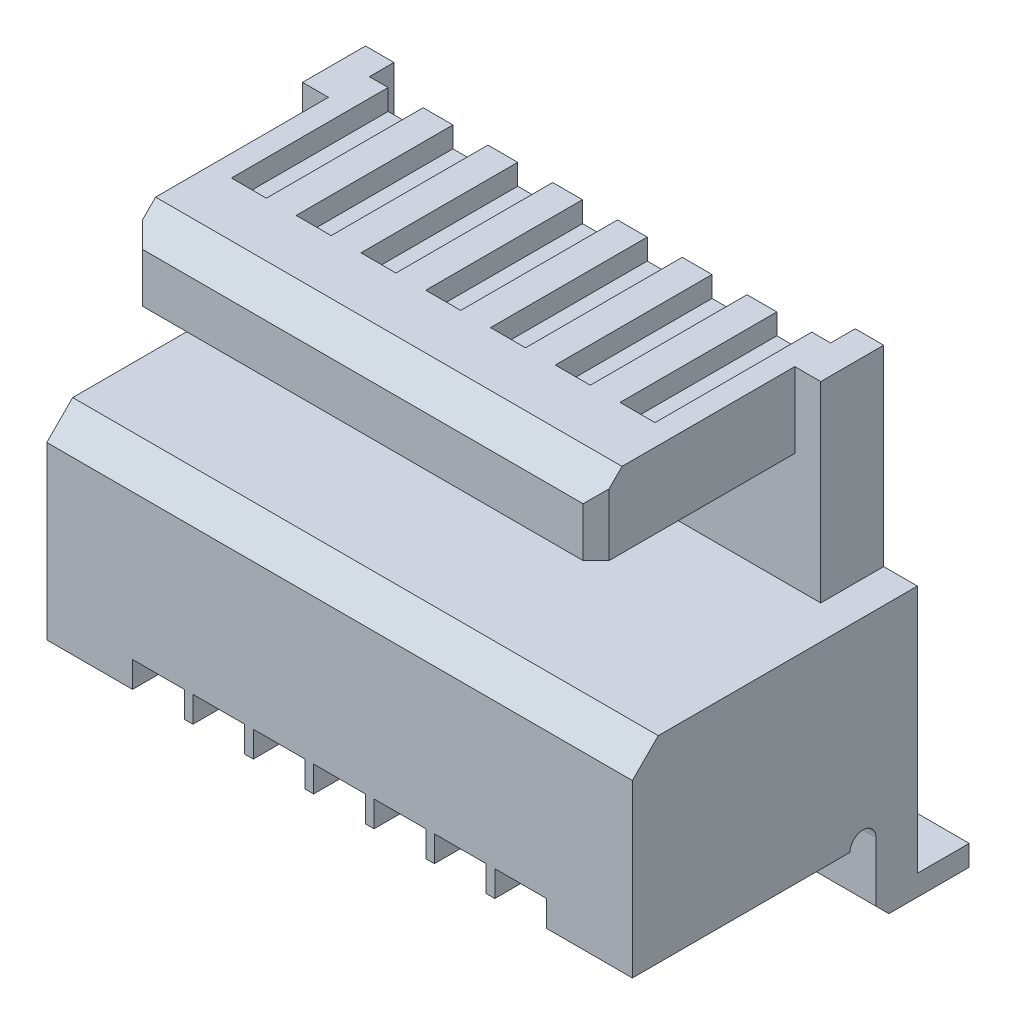
from build123d import *

# Parameters (mm, degrees)
BOSS_EXTRUDE1_DEPTH = 7.6
SKETCH2_W           = 17
SKETCH2_H           = 8.9
BOSS_EXTRUDE2_DEPTH = 2
SKETCH3_W           = 20
SKETCH3_H           = 2.43
BOSS_EXTRUDE3_DEPTH = 7.4
SKETCH4_W           = 18
SKETCH4_H           = 2.9
BOSS_EXTRUDE4_DEPTH = 7.67
CUT_EXTRUDE1_DEPTH  = 0.95
SKETCH6_W           = 1.35
SKETCH6_H           = 6.05
CUT_EXTRUDE2_DEPTH  = 0.8
CHAMFER1_SIZE       = 0.5
CHAMFER2_SIZE       = 1
CHAMFER3_SIZE       = 1
SKETCH7_W           = 2.8
SKETCH7_H           = 1.6
BOSS_EXTRUDE5_DEPTH = 2.8
SKETCH8_W           = 2.8
SKETCH8_H           = 0.8
BOSS_EXTRUDE6_DEPTH = 2
CUT_EXTRUDE3_DEPTH  = 30.270462928
CHAMFER4_SIZE       = 0.5
SKETCH10_W          = 2
SKETCH10_H          = 7.95
SKETCH10_W_2        = 1
CUT_EXTRUDE4_DEPTH  = 1
CUT_EXTRUDE5_DEPTH  = 1
SKETCH12_W          = 2
SKETCH12_H          = 1.1
CUT_EXTRUDE6_DEPTH  = 1


with BuildPart() as part:
    # Sketch1 → Boss-Extrude1 (new body)
    with BuildSketch(Plane(origin=(0, 0, 0), x_dir=(1, 0, 0), z_dir=(0, 1, 0))):
        Polygon((0, 0), (0, -11), (22.6, -11), (22.6, 0), (19.8, 0), (19.8, -8.9), (2.8, -8.9), (2.8, 0), align=None)
    extrude(amount=BOSS_EXTRUDE1_DEPTH)

    # Sketch2 → Boss-Extrude2 (add)
    with BuildSketch(Plane(origin=(0, 7.6, 0), x_dir=(1, 0, 0), z_dir=(0, 1, 0))):
        with Locations((11.3, -4.45)):
            Rectangle(SKETCH2_W, SKETCH2_H)
    extrude(amount=-BOSS_EXTRUDE2_DEPTH)

    # Sketch3 → Boss-Extrude3 (add)
    with BuildSketch(Plane(origin=(0, 7.6, 0), x_dir=(1, 0, 0), z_dir=(0, 1, 0))):
        with Locations((11.3, -1.215)):
            Rectangle(SKETCH3_W, SKETCH3_H)
    extrude(amount=BOSS_EXTRUDE3_DEPTH)

    # Sketch4 → Boss-Extrude4 (add)
    with BuildSketch(Plane.XY.offset(2.43)):
        with Locations((11.3, 13.55)):
            Rectangle(SKETCH4_W, SKETCH4_H)
    extrude(amount=BOSS_EXTRUDE4_DEPTH)

    # Sketch5 → Cut-Extrude1 (cut)
    with BuildSketch(Plane(origin=(0, 0, 0), x_dir=(-1, 0, 0), z_dir=(0, 0, -1))):
        Polygon((-19.8, 11.5), (-19.8, 5.6), (-2.8, 5.6), (-2.8, 11.5), (-2.4, 11.5), (-2.4, 15), (-20.2, 15), (-20.2, 11.5), align=None)
    extrude(amount=-CUT_EXTRUDE1_DEPTH, mode=Mode.SUBTRACT)

    # Sketch6 → Cut-Extrude2 (cut)
    with BuildSketch(Plane(origin=(0, 15, 0), x_dir=(1, 0, 0), z_dir=(0, 1, 0))):
        with Locations((3.8, -3.975)):
            Rectangle(SKETCH6_W, SKETCH6_H)
        with Locations((6.3, -3.975)):
            Rectangle(SKETCH6_W, SKETCH6_H)
        with Locations((8.8, -3.975)):
            Rectangle(SKETCH6_W, SKETCH6_H)
        with Locations((11.3, -3.975)):
            Rectangle(SKETCH6_W, SKETCH6_H)
        with Locations((13.8, -3.975)):
            Rectangle(SKETCH6_W, SKETCH6_H)
        with Locations((16.3, -3.975)):
            Rectangle(SKETCH6_W, SKETCH6_H)
        with Locations((18.8, -3.975)):
            Rectangle(SKETCH6_W, SKETCH6_H)
    extrude(amount=-CUT_EXTRUDE2_DEPTH, mode=Mode.SUBTRACT)

    # Chamfer1
    chamfer1_edges = [part.edges().sort_by_distance(p)[0] for p in [
        (20.3, 13.55, 10.1),
        (2.3, 13.55, 10.1),
    ]]
    chamfer(chamfer1_edges, length=CHAMFER1_SIZE)

    # Chamfer2
    chamfer2_edges = [part.edges().sort_by_distance(p)[0] for p in [
        (11.3, 15, 10.1),
    ]]
    chamfer(chamfer2_edges, length=CHAMFER2_SIZE)

    # Chamfer3
    chamfer3_edges = [part.edges().sort_by_distance(p)[0] for p in [
        (11.3, 7.6, 11),
    ]]
    chamfer(chamfer3_edges, length=CHAMFER3_SIZE)

    # Sketch7 → Boss-Extrude5 (add)
    with BuildSketch(Plane.XZ):
        with Locations((1.4, 0.8)):
            Rectangle(SKETCH7_W, SKETCH7_H)
        with Locations((21.2, 0.8)):
            Rectangle(SKETCH7_W, SKETCH7_H)
    extrude(amount=BOSS_EXTRUDE5_DEPTH)

    # Sketch8 → Boss-Extrude6 (add)
    with BuildSketch(Plane(origin=(0, 0, 0), x_dir=(-1, 0, 0), z_dir=(0, 0, -1))):
        with Locations((-21.2, -2.4)):
            Rectangle(SKETCH8_W, SKETCH8_H)
        with Locations((-1.4, -2.4)):
            Rectangle(SKETCH8_W, SKETCH8_H)
    extrude(amount=BOSS_EXTRUDE6_DEPTH)

    # Sketch9 → Cut-Extrude3 (cut, through all)
    with BuildSketch(Plane.ZY):
        with BuildLine():
            ThreePointArc((1.6, 0), (2.1, -0.5), (2.6, 0))
            Line((2.6, 0), (1.6, 0))
        make_face()
        with BuildLine():
            Line((1.6, 0), (2.6, 0))
            ThreePointArc((2.6, 0), (2.1, 0.5), (1.6, 0))
        make_face()
    extrude(amount=-CUT_EXTRUDE3_DEPTH, mode=Mode.SUBTRACT)

    # Chamfer4
    chamfer4_edges = [part.edges().sort_by_distance(p)[0] for p in [
        (1.4, -2.8, 1.6),
        (21.2, -2.8, 1.6),
    ]]
    chamfer(chamfer4_edges, length=CHAMFER4_SIZE)

    # Sketch10 → Cut-Extrude4 (cut)
    with BuildSketch(Plane.XZ.offset(-5.6)):
        with Locations((4.31, 4.925)):
            Rectangle(SKETCH10_W, SKETCH10_H)
        with Locations((6.64, 4.925)):
            Rectangle(SKETCH10_W, SKETCH10_H)
        with Locations((8.97, 4.925)):
            Rectangle(SKETCH10_W, SKETCH10_H)
        with Locations((11.8, 4.925)):
            Rectangle(SKETCH10_W_2, SKETCH10_H)
        with Locations((10.8, 4.925)):
            Rectangle(SKETCH10_W_2, SKETCH10_H)
        with Locations((13.63, 4.925)):
            Rectangle(SKETCH10_W, SKETCH10_H)
        with Locations((15.96, 4.925)):
            Rectangle(SKETCH10_W, SKETCH10_H)
        with Locations((18.29, 4.925)):
            Rectangle(SKETCH10_W, SKETCH10_H)
    extrude(amount=-CUT_EXTRUDE4_DEPTH, mode=Mode.SUBTRACT)

    # Sketch11 → Cut-Extrude5 (cut)
    with BuildSketch(Plane(origin=(0, 0, 8.9), x_dir=(-1, 0, 0), z_dir=(0, 0, -1))):
        Polygon((-19.29, 6.6), (-19.29, 5.6), (-19.29, 0), (-17.29, 0), (-17.29, 5.6), (-17.29, 6.6), align=None)
        Polygon((-16.96, 5.6), (-16.96, 0), (-14.96, 0), (-14.96, 5.6), (-14.96, 6.6), (-16.96, 6.6), align=None)
        Polygon((-14.63, 5.6), (-14.63, 0), (-12.63, 0), (-12.63, 5.6), (-12.63, 6.6), (-14.63, 6.6), align=None)
        Polygon((-12.3, 5.6), (-12.3, 0), (-10.3, 0), (-10.3, 5.6), (-10.3, 6.6), (-12.3, 6.6), align=None)
        Polygon((-9.97, 5.6), (-9.97, 0), (-7.97, 0), (-7.97, 5.6), (-7.97, 6.6), (-9.97, 6.6), align=None)
        Polygon((-7.64, 5.6), (-7.64, 0), (-5.64, 0), (-5.64, 5.6), (-5.64, 6.6), (-7.64, 6.6), align=None)
        Polygon((-5.31, 5.6), (-5.31, 0), (-3.31, 0), (-3.31, 5.6), (-3.31, 6.6), (-5.31, 6.6), align=None)
    extrude(amount=-CUT_EXTRUDE5_DEPTH, mode=Mode.SUBTRACT)

    # Sketch12 → Cut-Extrude6 (cut)
    with BuildSketch(Plane.XZ):
        with Locations((4.31, 10.45)):
            Rectangle(SKETCH12_W, SKETCH12_H)
        with Locations((6.64, 10.45)):
            Rectangle(SKETCH12_W, SKETCH12_H)
        with Locations((8.97, 10.45)):
            Rectangle(SKETCH12_W, SKETCH12_H)
        with Locations((11.3, 10.45)):
            Rectangle(SKETCH12_W, SKETCH12_H)
        with Locations((13.63, 10.45)):
            Rectangle(SKETCH12_W, SKETCH12_H)
        with Locations((15.96, 10.45)):
            Rectangle(SKETCH12_W, SKETCH12_H)
        with Locations((18.29, 10.45)):
            Rectangle(SKETCH12_W, SKETCH12_H)
    extrude(amount=-CUT_EXTRUDE6_DEPTH, mode=Mode.SUBTRACT)


solid = part.part
